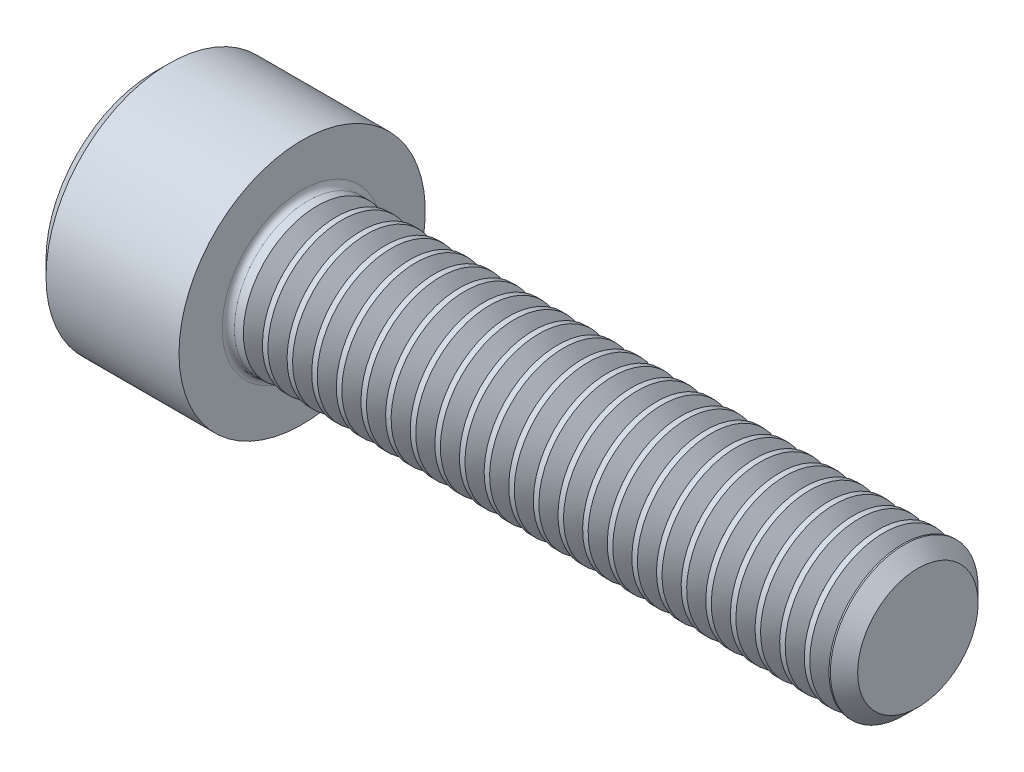
from build123d import *

# Parameters (mm, degrees)
FILLET1_R       = 0.25
HEX_2_DEPTH     = 3
THDSCHPAT_COUNT = 24
THDSCHPAT_PITCH = 1


with BuildPart() as part:
    # BodySke → Base-Revolve (revolve)
    with BuildSketch(Plane.XY, mode=Mode.PRIVATE) as base_revolve_sk:
        Polygon((0, 0), (0, 4.4), (0.6, 5), (6, 5), (6, 3), (30.4455, 3), (31, 2.4455), (31, 0), align=None)
    revolve(base_revolve_sk.sketch.rotate(Axis((-31.75, 0, 0), (1, 0, 0)), 90), axis=Axis((-31.75, 0, 0), (1, 0, 0)))

    # Fillet1
    fillet1_edges = [part.edges().sort_by_distance(p)[0] for p in [
        (6, 0, -3),
    ]]
    fillet(fillet1_edges, radius=FILLET1_R)

    # Sketch2 → Hex-PreBroach (revolve, cut)
    with BuildSketch(Plane.XY, mode=Mode.PRIVATE) as hex_prebroach_sk:
        Polygon((0, 2.542), (3, 2.542), (4.467624384, 0), (0, 0), align=None)
    revolve(hex_prebroach_sk.sketch.rotate(Axis((0, 0, 0), (1, 0, 0)), 90), axis=Axis((0, 0, 0), (1, 0, 0)), mode=Mode.SUBTRACT)

    # Sketch3 → Hex 2 (cut)
    with BuildSketch(Plane(origin=(0, 0, 0), x_dir=(0, 0.500000000000001, 0.866025403784438), z_dir=(-1, 0, 0))):
        Polygon((1.467624384, 2.542), (-1.467624384, 2.542), (-2.935248769, 0), (-1.467624384, -2.542), (1.467624384, -2.542), (2.935248769, 0), align=None)
    extrude(amount=-HEX_2_DEPTH, mode=Mode.SUBTRACT)

    # ThdSchSke → ThreadSchematic (revolve, cut)
    with BuildSketch(Plane.XY):
        Polygon((7, -2.4455), (6.61173492, -3), (6.61173492, -3.75), (7.38826508, -3.75), (7.38826508, -3), align=None)
    threadschematic = revolve(axis=Axis((-3.175, 0, 0), (1, 0, 0)), mode=Mode.SUBTRACT)

    # ThdSchPat: ThreadSchematic ×24
    with Locations(*[(i * THDSCHPAT_PITCH, 0, 0) for i in range(1, THDSCHPAT_COUNT)]):
        add(threadschematic, mode=Mode.SUBTRACT)


solid = part.part
